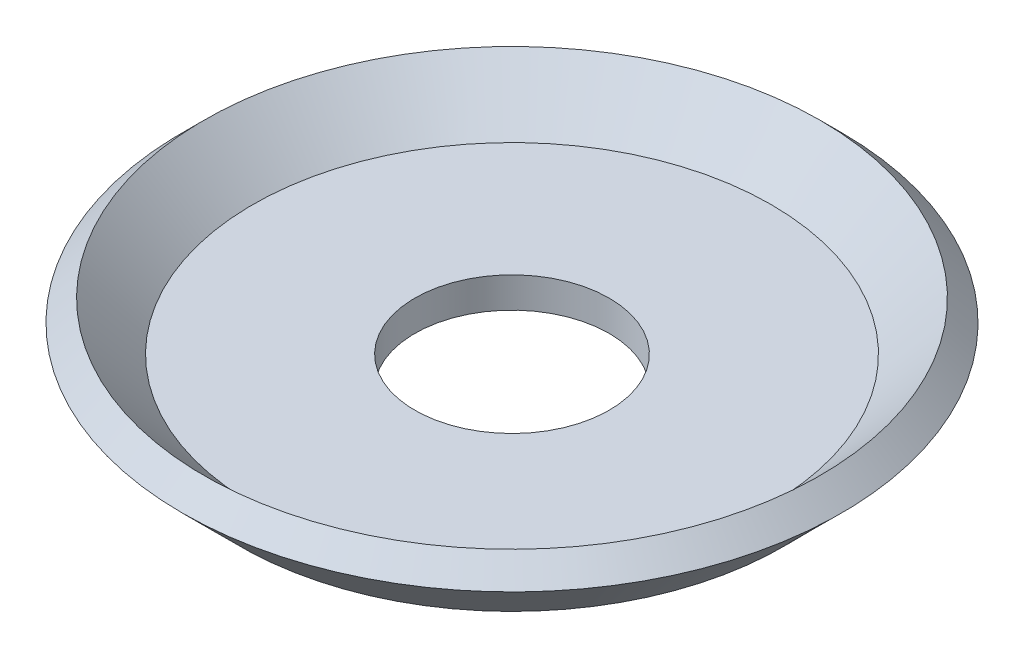
from build123d import *


with BuildPart() as part:
    # Sketch1 → Revolve1 (revolve)
    with BuildSketch(Plane(origin=(0, 0, 0), x_dir=(0, 0, -1), z_dir=(1, 0, 0)), mode=Mode.PRIVATE) as revolve1_sk:
        Polygon((-4.7625, 0), (-13.321320344, 0), (-16.149747468, 2.828427125), (-15.089087297, 3.889087297), (-12.7, 1.5), (-4.7625, 1.5), align=None)
    revolve(revolve1_sk.sketch.rotate(Axis((0, 0, 0), (0, 1, 0)), 180), axis=Axis((0, 0, 0), (0, 1, 0)))


solid = part.part
